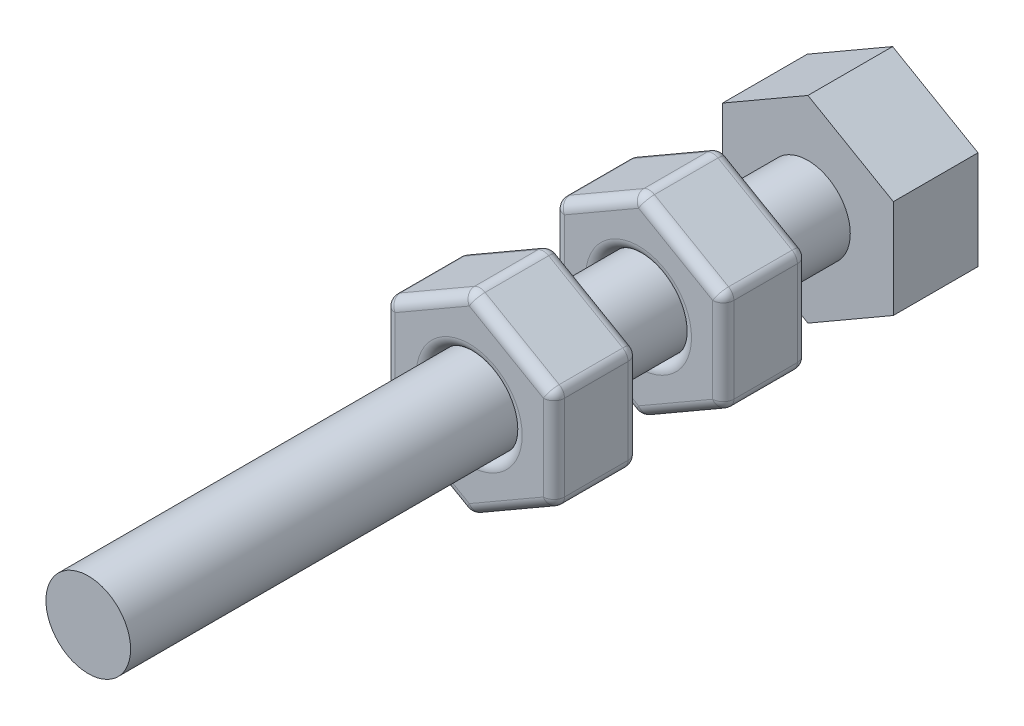
from build123d import *

# Parameters (mm, degrees)
SKETCH1_R                = 2
BOSS_EXTRUDE1_DEPTH      = 6
SKETCH1_2_R              = 2
CUT_EXTRUDE1_DEPTH       = 2
FILLET1_R                = 0.5
FILLET2_R                = 0.5
BOSS_EXTRUDE2_DEPTH      = 24
BOSS_EXTRUDE2_DEPTH_BACK = 14
SKETCH2_R                = 2
BOSS_EXTRUDE3_DEPTH      = 4


with BuildPart() as part:
    # Sketch1 → Boss-Extrude1 (new, symmetric)
    with BuildSketch(Plane.XY):
        Polygon((0, 4.618802154), (-4, 2.309401077), (-4, -2.309401077), (0, -4.618802154), (4, -2.309401077), (4, 2.309401077), align=None)
        Circle(SKETCH1_R, mode=Mode.SUBTRACT)
    extrude(amount=BOSS_EXTRUDE1_DEPTH, both=True)

    # Sketch1<2> → Cut-Extrude1 (cut, symmetric)
    with BuildSketch(Plane.XY):
        Polygon((0, 4.618802154), (-4, 2.309401077), (-4, -2.309401077), (0, -4.618802154), (4, -2.309401077), (4, 2.309401077), align=None)
        Circle(SKETCH1_2_R, mode=Mode.SUBTRACT)
    extrude(amount=CUT_EXTRUDE1_DEPTH, both=True, mode=Mode.SUBTRACT)


with BuildPart() as cut_extrude1_piece_1:
    # of the separate pieces the step leaves, piece 1, a body of its own (cut_extrude1_pieces)
    add(part.part.solids().sort_by_distance((0, 4.618802154, -2))[0])

    # Fillet2
    fillet2_edges = [cut_extrude1_piece_1.edges().sort_by_distance(p)[0] for p in [
        (4, 2.309401077, -4),
        (4, -2.309401077, -4),
        (0, -4.618802154, -4),
        (-4, -2.309401077, -4),
        (-4, 2.309401077, -4),
        (0, 4.618802154, -4),
        (4, 0, -2),
        (2, -3.464101615, -2),
        (-2, -3.464101615, -2),
        (-4, 0, -2),
        (-2, 3.464101615, -2),
        (2, 3.464101615, -2),
        (-2, 0, -2),
        (-2, 0, -6),
        (-2, 3.464101615, -6),
        (-4, 0, -6),
        (-2, -3.464101615, -6),
        (2, -3.464101615, -6),
        (4, 0, -6),
        (2, 3.464101615, -6),
    ]]
    fillet(fillet2_edges, radius=FILLET2_R)



with BuildPart() as cut_extrude1_piece_2:
    # of the separate pieces the step leaves, piece 2, a body of its own (cut_extrude1_pieces)
    add(part.part.solids().sort_by_distance((0, 4.618802154, 6))[0])

    # Fillet1
    fillet1_edges = [cut_extrude1_piece_2.edges().sort_by_distance(p)[0] for p in [
        (0, -4.618802154, 4),
        (-4, -2.309401077, 4),
        (2, -3.464101615, 6),
        (-2, -3.464101615, 6),
        (-4, 0, 6),
        (2, 3.464101615, 6),
        (-2, 3.464101615, 6),
        (-4, 2.309401077, 4),
        (0, 4.618802154, 4),
        (4, 0, 6),
        (4, 2.309401077, 4),
        (4, -2.309401077, 4),
        (-2, 3.464101615, 2),
        (-4, 0, 2),
        (-2, -3.464101615, 2),
        (2, -3.464101615, 2),
        (4, 0, 2),
        (2, 3.464101615, 2),
        (-2, 0, 2),
        (-2, 0, 6),
    ]]
    fillet(fillet1_edges, radius=FILLET1_R)


with BuildPart() as cut_extrude1_piece_1_1:
    add(cut_extrude1_piece_1.part)

    add(cut_extrude1_piece_2.part)  # Boss-Extrude2 merges Cut-Extrude1 piece 2
    # Sketch2 → Boss-Extrude2 (add, two sides: drawn at the far end of the back side and taken through both)
    with BuildSketch(Plane.XY.offset(-BOSS_EXTRUDE2_DEPTH_BACK)):
        Circle(SKETCH2_R)
    extrude(amount=BOSS_EXTRUDE2_DEPTH + BOSS_EXTRUDE2_DEPTH_BACK)

    # Sketch3 → Boss-Extrude3 (add)
    with BuildSketch(Plane(origin=(0, 0, -14), x_dir=(-1, 0, 0), z_dir=(0, 0, -1))):
        Polygon((0, 4.658071481), (-4.034008235, 2.32903574), (-4.034008235, -2.32903574), (0, -4.658071481), (4.034008235, -2.32903574), (4.034008235, 2.32903574), align=None)
    extrude(amount=-BOSS_EXTRUDE3_DEPTH)


solid = cut_extrude1_piece_1_1.part
